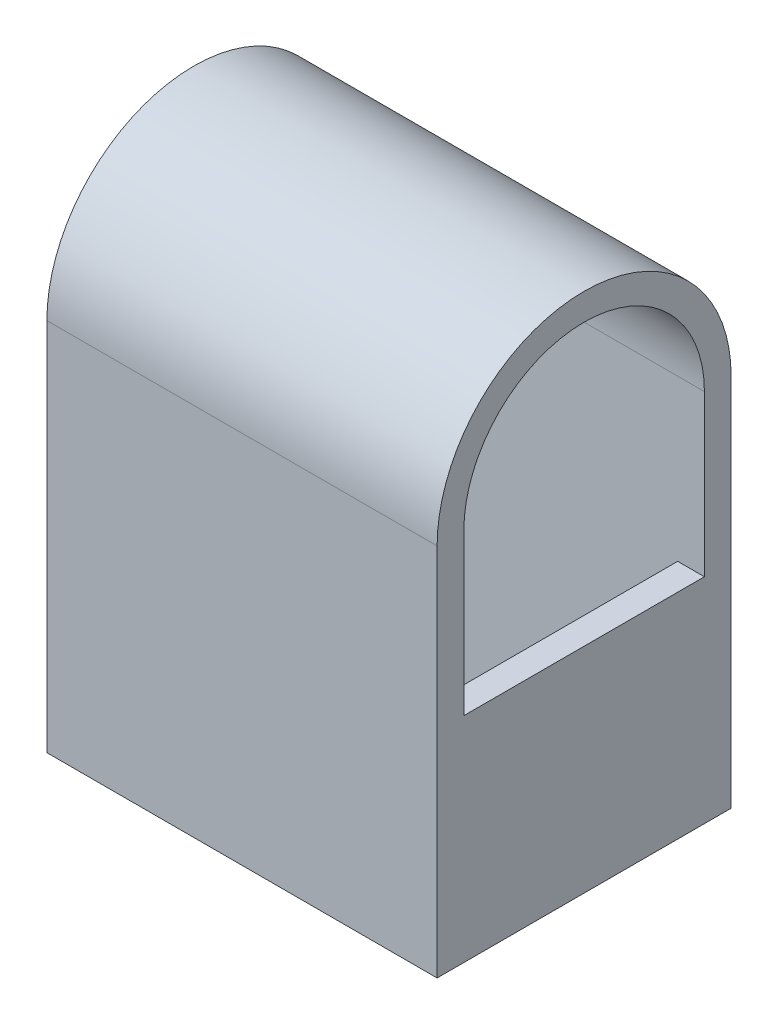
from build123d import *

# Parameters (mm, degrees)
SKETCH1_W            = 18.542
SKETCH1_H            = 17.78
BOSS_EXTRUDE4_DEPTH  = 1.27
SKETCH4_W            = 18.542
SKETCH4_H            = 17.78
BOSS_EXTRUDE5_DEPTH  = 1.27
BOSS_EXTRUDE6_DEPTH  = 18.542
SKETCH7_W            = 11.43
SKETCH7_H            = 10.16
BOSS_EXTRUDE7_DEPTH  = 1.27
SKETCH12_W           = 12.7
SKETCH12_H           = 12.7
BOSS_EXTRUDE11_DEPTH = 2.286
CUT_EXTRUDE2_DEPTH   = 23.616343139
BOSS_EXTRUDE12_DEPTH = 1.27


with BuildPart() as part:
    # Sketch1 → Boss-Extrude4 (new body)
    with BuildSketch(Plane.XY):
        Rectangle(SKETCH1_W, SKETCH1_H)
    extrude(amount=-BOSS_EXTRUDE4_DEPTH)



with BuildPart() as body_2:
    # Sketch4 → Boss-Extrude5 (new body)
    with BuildSketch(Plane.XY.offset(-13.97)):
        Rectangle(SKETCH4_W, SKETCH4_H)
    extrude(amount=BOSS_EXTRUDE5_DEPTH)


with BuildPart() as part_1:
    add(part.part)

    add(body_2.part)  # Boss-Extrude6 merges body 2
    # Sketch6 → Boss-Extrude6 (add)
    with BuildSketch(Plane.ZY.offset(9.271)):
        with BuildLine():
            Line((-13.97, 8.89), (-12.7, 8.89))
            ThreePointArc((-12.7, 8.89), (-6.985, 14.605), (-1.27, 8.89))
            Line((-1.27, 8.89), (0, 8.89))
            ThreePointArc((0, 8.89), (-6.985, 15.875), (-13.97, 8.89))
        make_face()
    extrude(amount=-BOSS_EXTRUDE6_DEPTH)

    # Sketch7 → Boss-Extrude7 (add)
    with BuildSketch(Plane.ZY.offset(9.271)):
        with Locations((-6.985, -3.81)):
            Rectangle(SKETCH7_W, SKETCH7_H)
    extrude(amount=-BOSS_EXTRUDE7_DEPTH)

    # Sketch12 → Boss-Extrude11 (add)
    with BuildSketch(Plane(origin=(0, 0, -13.97), x_dir=(-1, 0, 0), z_dir=(0, 0, -1))):
        with Locations((0, -2.54)):
            Rectangle(SKETCH12_W, SKETCH12_H)
    extrude(amount=BOSS_EXTRUDE11_DEPTH)

    # Sketch13 → Cut-Extrude2 (cut, through all)
    with BuildSketch(Plane(origin=(0, 3.81, 0), x_dir=(1, 0, 0), z_dir=(0, 1, 0))):
        Polygon((-5.08, 13.97), (5.08, 13.97), (5.08, 15.493275397), (-5.08, 15.748), align=None)
    extrude(amount=-CUT_EXTRUDE2_DEPTH, mode=Mode.SUBTRACT)

    # Sketch8 → Boss-Extrude12 (add)
    with BuildSketch(Plane(origin=(9.271, 0, 0), x_dir=(0, 0, -1), z_dir=(1, 0, 0))):
        Polygon((1.905, 1.27), (1.27, 1.27), (1.27, -8.89), (12.7, -8.89), (12.7, 1.27), (10.795, 1.27), align=None)
    extrude(amount=-BOSS_EXTRUDE12_DEPTH)


solid = part_1.part
